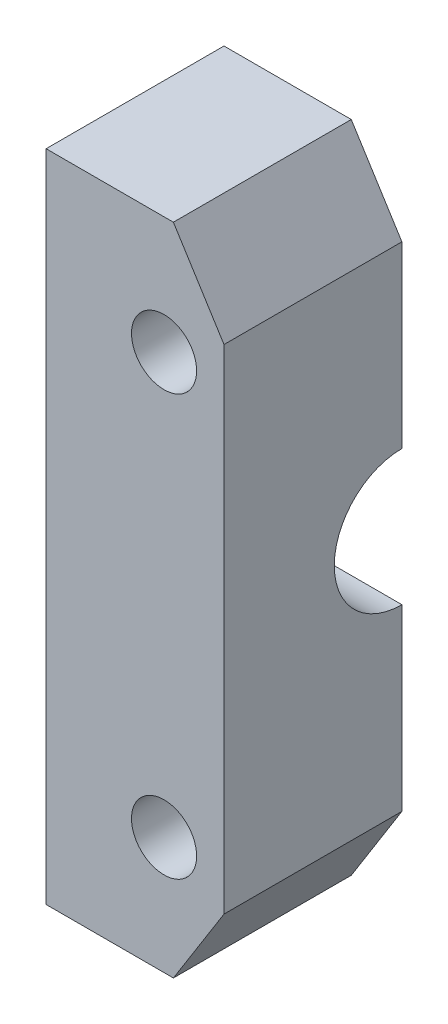
from build123d import *

# Parameters (mm, degrees)
SKETCH1_R           = 2.325
SKETCH1_W           = 7.749999992
SKETCH1_H           = 9.652
BOSS_EXTRUDE1_DEPTH = 12.7
SKETCH2_R           = 4.826
CUT_EXTRUDE1_DEPTH  = 8


with BuildPart() as part:
    # Sketch1 → Boss-Extrude1 (new body)
    # profile 1 of 2: a face of its own
    with BuildSketch(Plane.XY):
        Polygon((90.626647956, 23.365008212), (81.539999992, 23.365008212), (81.539999992, -23.365008212), (90.626647956, -23.365008212), (94.239999992, -17.607359271), (94.239999992, -4.826), (86.49, -4.826), (86.49, 4.826), (94.239999992, 4.826), (94.239999992, 17.607359271), align=None)
        with Locations((89.96, -15)):
            Circle(SKETCH1_R, mode=Mode.SUBTRACT)
        with Locations((89.96, 15)):
            Circle(SKETCH1_R, mode=Mode.SUBTRACT)
    # profile 2 of 2: a face of its own
    with BuildSketch(Plane.XY):
        with Locations((90.364999996, 0)):
            Rectangle(SKETCH1_W, SKETCH1_H)
    extrude(amount=BOSS_EXTRUDE1_DEPTH)

    # Sketch2 → Cut-Extrude1 (cut)
    with BuildSketch(Plane(origin=(94.239999992, 0, 0), x_dir=(0, 0, -1), z_dir=(1, 0, 0))):
        Circle(SKETCH2_R)
    extrude(amount=-CUT_EXTRUDE1_DEPTH, mode=Mode.SUBTRACT)


solid = part.part
